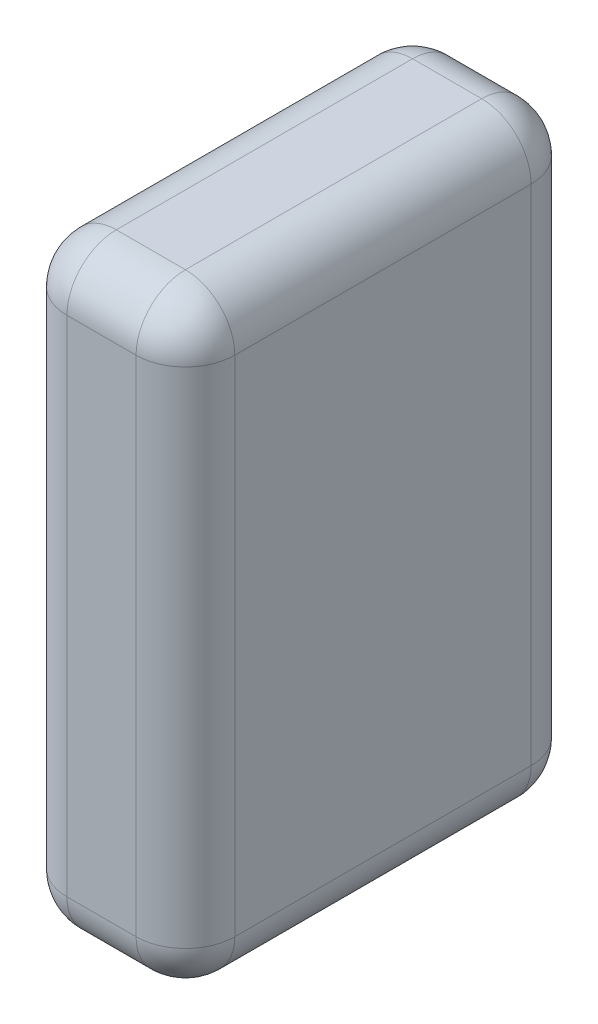
from build123d import *

# Parameters (mm, degrees)
FRONTSKETCH_W       = 17
FRONTSKETCH_H       = 61
BOSS_EXTRUDE1_DEPTH = 40
FILLET1_R           = 5


with BuildPart() as part:
    # FrontSketch → Boss-Extrude1 (new body)
    with BuildSketch(Plane.XY):
        Rectangle(FRONTSKETCH_W, FRONTSKETCH_H)
    extrude(amount=BOSS_EXTRUDE1_DEPTH)

    # Fillet1
    fillet1_edges = [part.edges().sort_by_distance(p)[0] for p in [
        (8.5, 0, 40),
        (0, 30.5, 40),
        (-8.5, 0, 40),
        (0, 30.5, 0),
        (8.5, 0, 0),
        (0, -30.5, 0),
        (-8.5, 0, 0),
        (-8.5, 30.5, 20),
        (8.5, 30.5, 20),
        (8.5, -30.5, 20),
        (-8.5, -30.5, 20),
        (0, -30.5, 40),
    ]]
    fillet(fillet1_edges, radius=FILLET1_R)


solid = part.part
